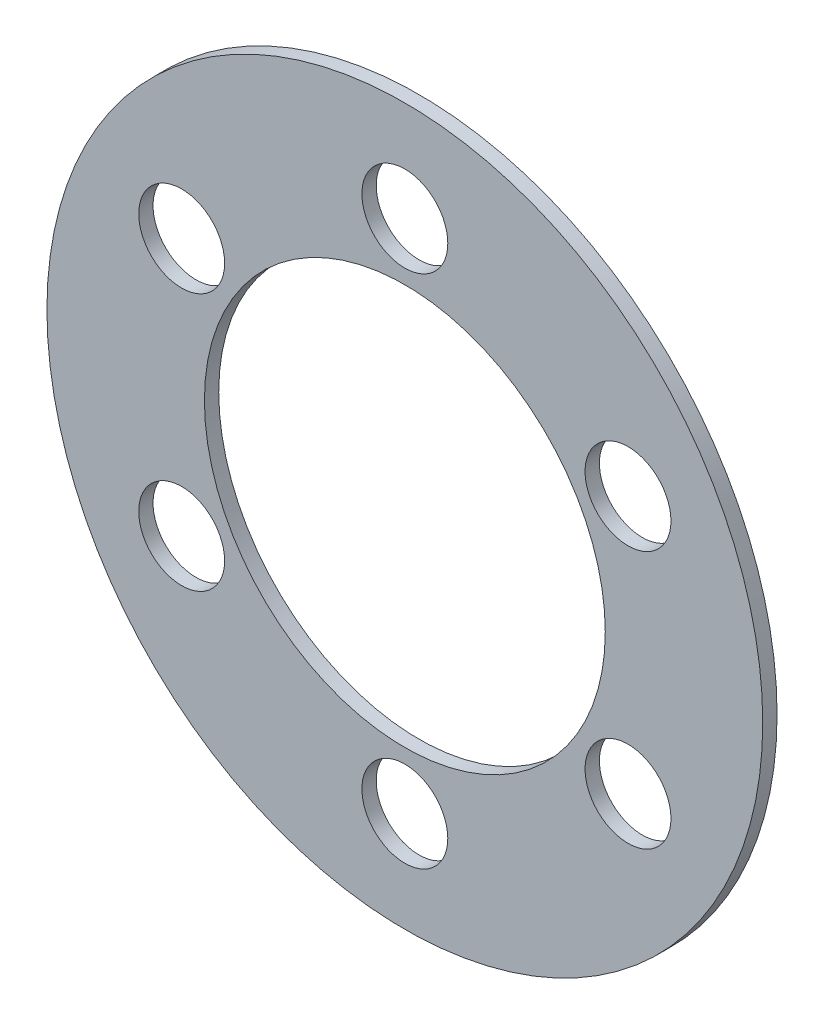
from build123d import *

# Parameters (mm, degrees)
SKETCH_1_R      = 12.5
SKETCH_1_R_2    = 7
SKETCH_1_R_3    = 1.5
EXTRUDE_1_DEPTH = 0.5


with BuildPart() as part:
    # Эскиз1 → Бобышка-Вытянуть1 (new body)
    with BuildSketch(Plane.XY):
        Circle(SKETCH_1_R)
        Circle(SKETCH_1_R_2, mode=Mode.SUBTRACT)
        with Locations((0, 9)):
            Circle(SKETCH_1_R_3, mode=Mode.SUBTRACT)
        with Locations((7.794228634, 4.5)):
            Circle(SKETCH_1_R_3, mode=Mode.SUBTRACT)
        with Locations((7.794228634, -4.5)):
            Circle(SKETCH_1_R_3, mode=Mode.SUBTRACT)
        with Locations((0, -9)):
            Circle(SKETCH_1_R_3, mode=Mode.SUBTRACT)
        with Locations((-7.794228634, -4.5)):
            Circle(SKETCH_1_R_3, mode=Mode.SUBTRACT)
        with Locations((-7.794228634, 4.5)):
            Circle(SKETCH_1_R_3, mode=Mode.SUBTRACT)
    extrude(amount=EXTRUDE_1_DEPTH)


solid = part.part
